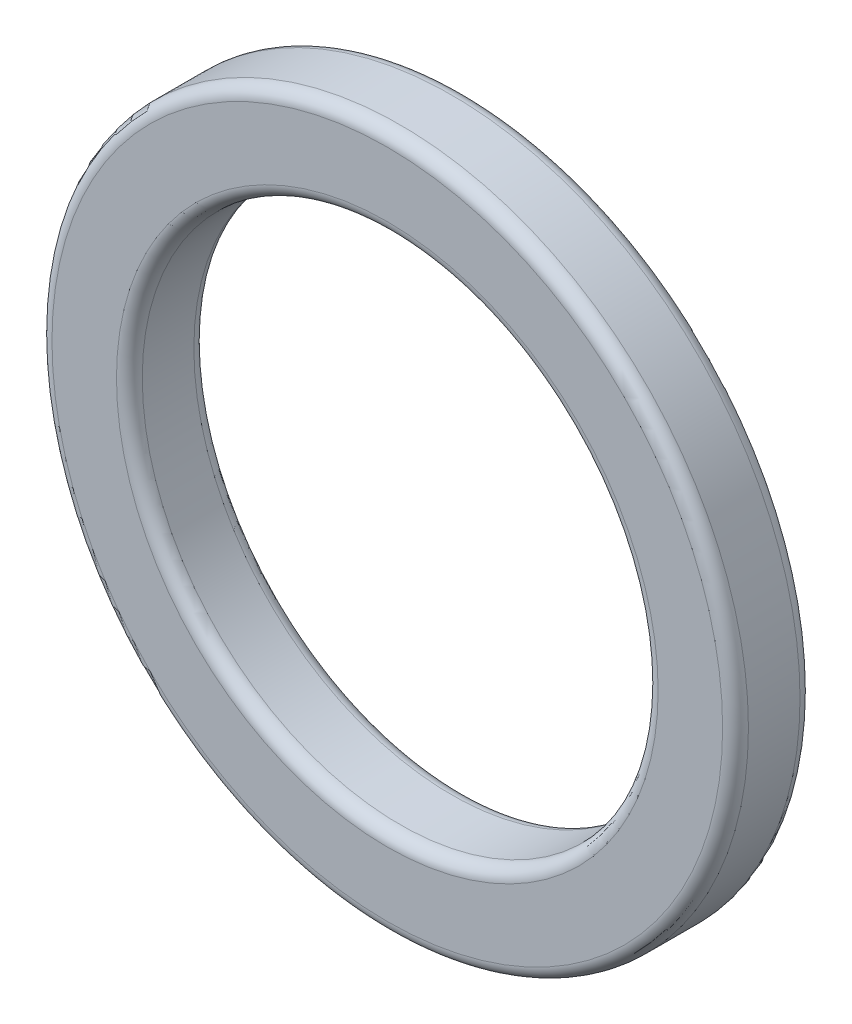
from build123d import *

# Parameters (mm, degrees)
SKETCH1_R           = 0.675
SKETCH1_R_2         = 0.5
BOSS_EXTRUDE1_DEPTH = 0.15
FILLET1_R           = 0.025


with BuildPart() as part:
    # Sketch1 → Boss-Extrude1 (new body)
    with BuildSketch(Plane.XY):
        Circle(SKETCH1_R)
        Circle(SKETCH1_R_2, mode=Mode.SUBTRACT)
    extrude(amount=BOSS_EXTRUDE1_DEPTH)

    # Fillet1
    fillet1_edges = [part.edges().sort_by_distance(p)[0] for p in [
        (-0.675, 0, 0),
        (-0.675, 0, 0.15),
        (-0.5, 0, 0),
        (-0.5, 0, 0.15),
    ]]
    fillet(fillet1_edges, radius=FILLET1_R)


solid = part.part
